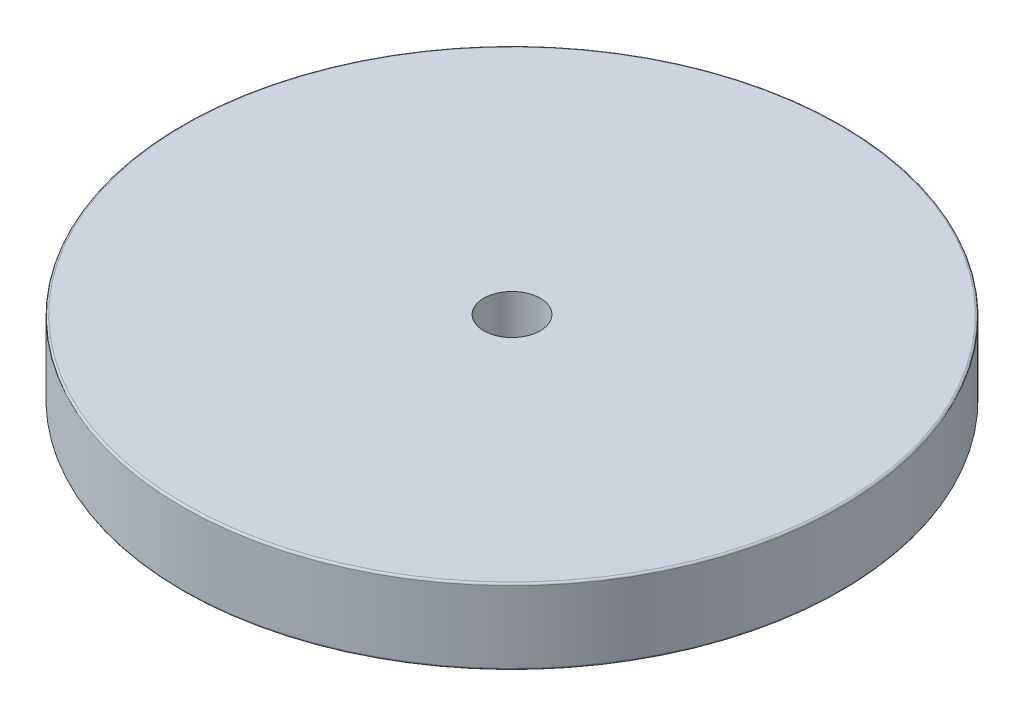
from build123d import *

# Parameters (mm, degrees)
SKETCH1_R           = 175
BOSS_EXTRUDE1_DEPTH = 40
SKETCH2_R           = 15
CUT_EXTRUDE1_DEPTH  = 251.699022734
FILLET1_R           = 1


with BuildPart() as part:
    # Sketch1 → Boss-Extrude1 (new body)
    with BuildSketch(Plane(origin=(0, 0, 0), x_dir=(1, 0, 0), z_dir=(0, 1, 0))):
        with Locations(Location((0, 0, 0), (0, 0, 270))):
            Circle(SKETCH1_R)
    extrude(amount=BOSS_EXTRUDE1_DEPTH)

    # Sketch2 → Cut-Extrude1 (cut, through all)
    with BuildSketch(Plane(origin=(0, 40, 0), x_dir=(1, 0, 0), z_dir=(0, 1, 0))):
        with Locations(Location((0, 0, 0), (0, 0, 270))):
            Circle(SKETCH2_R)
    extrude(amount=-CUT_EXTRUDE1_DEPTH, mode=Mode.SUBTRACT)

    # Fillet1
    fillet1_edges = [part.edges().sort_by_distance(p)[0] for p in [
        (0, 0, -175),
        (0, 40, -175),
    ]]
    fillet(fillet1_edges, radius=FILLET1_R)


solid = part.part
